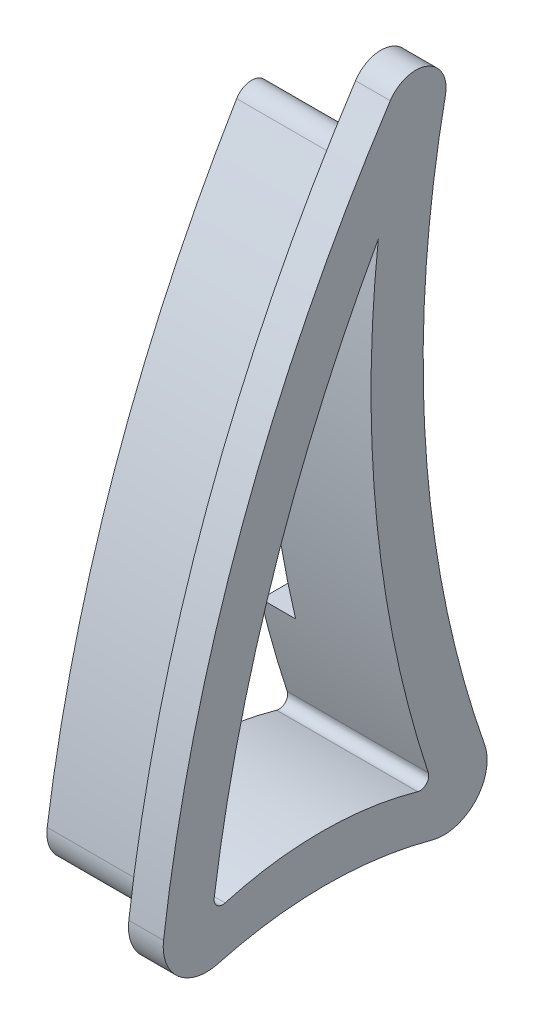
from build123d import *

# Parameters (mm, degrees)
BOSS_EXTRUDE1_DEPTH = 76.2
SKETCH2_W           = 6.985
SKETCH2_H           = 9.525
CUT_EXTRUDE1_DEPTH  = 119.84173867
CUT_EXTRUDE2_DEPTH  = 119.84173867
CUT_EXTRUDE3_DEPTH  = 119.84173867
FILLET1_R           = 2.54
CUT_EXTRUDE4_DEPTH  = 5.08
CUT_EXTRUDE6_DEPTH  = 15.113
FILLET2_R           = 0.508
BOSS_EXTRUDE2_DEPTH = 15.5575
BOSS_EXTRUDE3_DEPTH = 5.08
CUT_EXTRUDE7_DEPTH  = 5.08


with BuildPart() as part:
    # Sketch1 → Boss-Extrude1 (new body)
    with BuildSketch(Plane.XY):
        Polygon((-15.5575, 76.2), (15.5575, 76.2), (15.5575, -76.2), (7.845485509, -76.2), (9.525, -85.725), (-9.525, -85.725), (-7.845485509, -76.2), (-15.5575, -76.2), align=None)
    extrude(amount=BOSS_EXTRUDE1_DEPTH)

    # Sketch2 → Cut-Extrude1 (cut, through all)
    with BuildSketch(Plane(origin=(15.5575, 0, 0), x_dir=(0, 0, -1), z_dir=(1, 0, 0))):
        with Locations((-3.4925, -80.9625)):
            Rectangle(SKETCH2_W, SKETCH2_H)
    extrude(amount=-CUT_EXTRUDE1_DEPTH, mode=Mode.SUBTRACT)

    # Sketch3 → Cut-Extrude2 (cut, through all)
    with BuildSketch(Plane(origin=(15.5575, 0, 0), x_dir=(0, 0, -1), z_dir=(1, 0, 0))):
        with BuildLine():
            Line((-76.2, -85.725), (-76.2, -76.2))
            Line((-76.2, -76.2), (-76.2, 76.2))
            Line((-76.2, 76.2), (-6.541803462, 76.2))
            ThreePointArc((-6.541803462, 76.2), (-58.046669251, 2.411215556), (-76.2, -85.725))
        make_face()
        with BuildLine():
            Line((0, -76.2), (0, 67.75939176))
            ThreePointArc((0, 67.75939176), (-18.20597202, -4.22030412), (0, -76.2))
        make_face()
    extrude(amount=-CUT_EXTRUDE2_DEPTH, mode=Mode.SUBTRACT)

    # Sketch6 → Cut-Extrude3 (cut, through all)
    with BuildSketch(Plane(origin=(15.5575, 0, 0), x_dir=(0, 0, -1), z_dir=(1, 0, 0))):
        with BuildLine():
            ThreePointArc((-28.934409948, -61.883434575), (-23.879909813, -60.517759582), (-22.716254779, -55.412963136))
            ThreePointArc((-22.716254779, -55.412963136), (-30.753414225, -11.294498854), (-26.546552055, 33.352305435))
            ThreePointArc((-26.546552055, 33.352305435), (-49.181053892, -9.446405872), (-61.429710833, -56.286781256))
            ThreePointArc((-61.429710833, -56.286781256), (-59.737369376, -60.827463042), (-55.008021131, -61.883434575))
            ThreePointArc((-55.008021131, -61.883434575), (-41.971215539, -60.062859411), (-28.934409948, -61.883434575))
        make_face()
    extrude(amount=-CUT_EXTRUDE3_DEPTH, mode=Mode.SUBTRACT)

    # Fillet1
    fillet1_edges = [part.edges().sort_by_distance(p)[0] for p in [
        (0, 33.352305435, 26.546552055),
    ]]
    fillet(fillet1_edges, radius=FILLET1_R)

    # Sketch7 → Cut-Extrude4 (cut, symmetric)
    with BuildSketch(Plane(origin=(0, 0, 0), x_dir=(0, 0, -1), z_dir=(1, 0, 0))):
        with BuildLine():
            Line((-30.699128799, 4.016230293), (-17.981752538, 4.016230293))
            ThreePointArc((-17.981752538, 4.016230293), (-17.415803594, -19.667907964), (-13.161921654, -42.973769707))
            Line((-13.161921654, -42.973769707), (-26.264177108, -42.973769707))
            ThreePointArc((-26.264177108, -42.973769707), (-30.179968378, -19.639057999), (-30.699128799, 4.016230293))
        make_face()
    extrude(amount=CUT_EXTRUDE4_DEPTH, both=True, mode=Mode.SUBTRACT)

    # Sketch10 → Cut-Extrude6 (cut, symmetric)
    with BuildSketch(Plane(origin=(15.5575, 76.2, 6.541803462), x_dir=(-1, 0, 0), z_dir=(0, -0.7903999954772005, -0.6125910929401777))):
        Polygon((0, 5.170641427), (6.985, 5.170641427), (0, -3.655858573), align=None)
        Polygon((31.115, 5.170641427), (31.115, -3.655858573), (24.13, 5.170641427), align=None)
    extrude(amount=CUT_EXTRUDE6_DEPTH, both=True, mode=Mode.SUBTRACT)

    # Fillet2
    fillet2_edges = [part.edges().sort_by_distance(p)[0] for p in [
        (-15.5575, 5.090891194, 56.873019023),
        (-14.111333502, 74.930435776, 7.871138317),
        (0, 76.2, 6.541803462),
        (15.5575, 5.090891194, 56.873019023),
        (14.111333502, 74.930435776, 7.871138317),
    ]]
    fillet(fillet2_edges, radius=FILLET2_R)


with BuildPart() as body_2:
    # Sketch11 → Boss-Extrude2 (new body)
    with BuildSketch(Plane(origin=(15.5575, 0, 0), x_dir=(0, 0, -1), z_dir=(1, 0, 0))):
        with BuildLine():
            ThreePointArc((-61.429710833, -56.286781256), (-59.737369376, -60.827463042), (-55.008021131, -61.883434575))
            ThreePointArc((-55.008021131, -61.883434575), (-41.971215539, -60.062859411), (-28.934409948, -61.883434575))
            ThreePointArc((-28.934409948, -61.883434575), (-23.879909813, -60.517759582), (-22.716254779, -55.412963136))
            ThreePointArc((-22.716254779, -55.412963136), (-30.33926448, -17.846197276), (-29.038721333, 20.464124591))
            ThreePointArc((-29.038721333, 20.464124591), (-30.691356883, 23.236746406), (-33.730314595, 22.14891737))
            ThreePointArc((-33.730314595, 22.14891737), (-51.496194807, -15.685940761), (-61.429710833, -56.286781256))
        make_face()
        with BuildLine():
            ThreePointArc((-57.657212561, -56.820032407), (-57.234127197, -57.955202853), (-56.051790136, -58.219195736))
            ThreePointArc((-56.051790136, -58.219195736), (-41.971215539, -56.252859411), (-27.890640943, -58.219195736))
            ThreePointArc((-27.890640943, -58.219195736), (-26.62701591, -57.877776988), (-26.336102151, -56.601577877))
            ThreePointArc((-26.336102151, -56.601577877), (-33.838316864, -21.365349504), (-33.651053161, 14.660196264))
            ThreePointArc((-33.651053161, 14.660196264), (-48.944068981, -19.975014906), (-57.657212561, -56.820032407))
        make_face(mode=Mode.SUBTRACT)
    extrude(amount=-BOSS_EXTRUDE2_DEPTH)

    # Sketch13 → Cut-Extrude7 (cut, symmetric)
    with BuildSketch(Plane(origin=(0, 0, 0), x_dir=(0, 0, -1), z_dir=(1, 0, 0))):
        with BuildLine():
            Line((-17.981752538, 4.016230293), (-34.513828125, 4.016230293))
            ThreePointArc((-34.513828125, 4.016230293), (-34.007192205, -19.631694302), (-30.182465628, -42.973769707))
            Line((-30.182465628, -42.973769707), (-13.161921654, -42.973769707))
            ThreePointArc((-13.161921654, -42.973769707), (-17.415803594, -19.667907964), (-17.981752538, 4.016230293))
        make_face()
    extrude(amount=CUT_EXTRUDE7_DEPTH, both=True, mode=Mode.SUBTRACT)


with BuildPart() as body_3:
    # Sketch12 → Boss-Extrude3 (new body)
    with BuildSketch(Plane(origin=(15.5575, 0, 0), x_dir=(0, 0, -1), z_dir=(1, 0, 0))):
        with BuildLine():
            ThreePointArc((-23.831738773, 27.962776346), (-26.492538641, 32.964962799), (-31.905127941, 31.28996957))
            ThreePointArc((-31.905127941, 31.28996957), (-53.570754409, -11.710044351), (-65.056281593, -58.469890723))
            ThreePointArc((-65.056281593, -58.469890723), (-62.925669808, -64.071096093), (-57.083298558, -65.405152448))
            ThreePointArc((-57.083298558, -65.405152448), (-41.422387692, -63.30256815), (-25.761476826, -65.405152448))
            ThreePointArc((-25.761476826, -65.405152448), (-19.442461008, -63.610654229), (-18.093267187, -57.18182379))
            ThreePointArc((-18.093267187, -57.18182379), (-26.733177439, -14.998448579), (-23.831738773, 27.962776346))
        make_face()
        with BuildLine():
            ThreePointArc((-27.890640943, -58.219195736), (-26.62701591, -57.877776988), (-26.336102151, -56.601577877))
            ThreePointArc((-26.336102151, -56.601577877), (-33.838316864, -21.365349504), (-33.651053161, 14.660196264))
            ThreePointArc((-33.651053161, 14.660196264), (-48.944068981, -19.975014906), (-57.657212561, -56.820032407))
            ThreePointArc((-57.657212561, -56.820032407), (-57.234127197, -57.955202853), (-56.051790136, -58.219195736))
            ThreePointArc((-56.051790136, -58.219195736), (-41.971215539, -56.252859411), (-27.890640943, -58.219195736))
        make_face(mode=Mode.SUBTRACT)
    extrude(amount=BOSS_EXTRUDE3_DEPTH)


with BuildPart() as body_2_1:
    add(body_2.part)

    # Combine1: union body 3
    add(body_3.part)


solid = body_2_1.part
